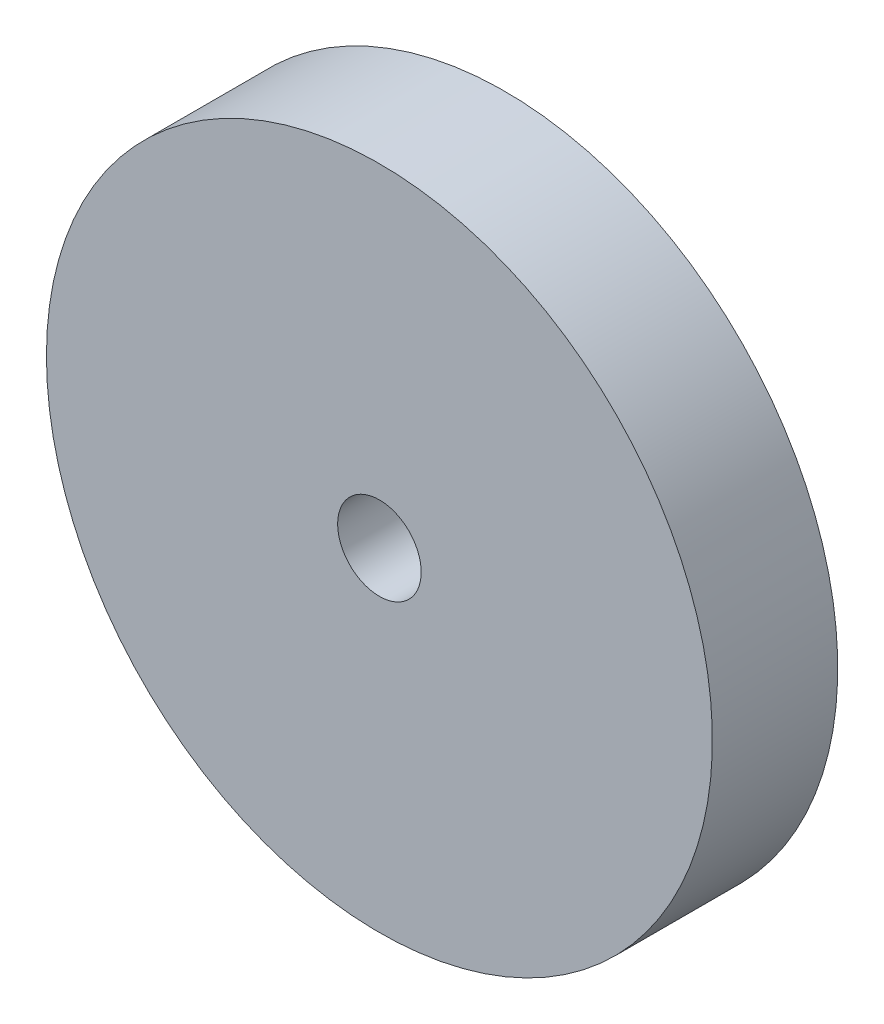
from build123d import *

# Parameters (mm, degrees)
SKETCH1_R           = 202.4
SKETCH1_R_2         = 25.4
BOSS_EXTRUDE1_DEPTH = 76.2


with BuildPart() as part:
    # Sketch1 → Boss-Extrude1 (new body)
    with BuildSketch(Plane.XY):
        with Locations(Location((0, 0, 0), (0, 0, 180))):
            Circle(SKETCH1_R)
        with Locations(Location((0, 0, 0), (0, 0, 180))):
            Circle(SKETCH1_R_2, mode=Mode.SUBTRACT)
    extrude(amount=BOSS_EXTRUDE1_DEPTH)


solid = part.part
